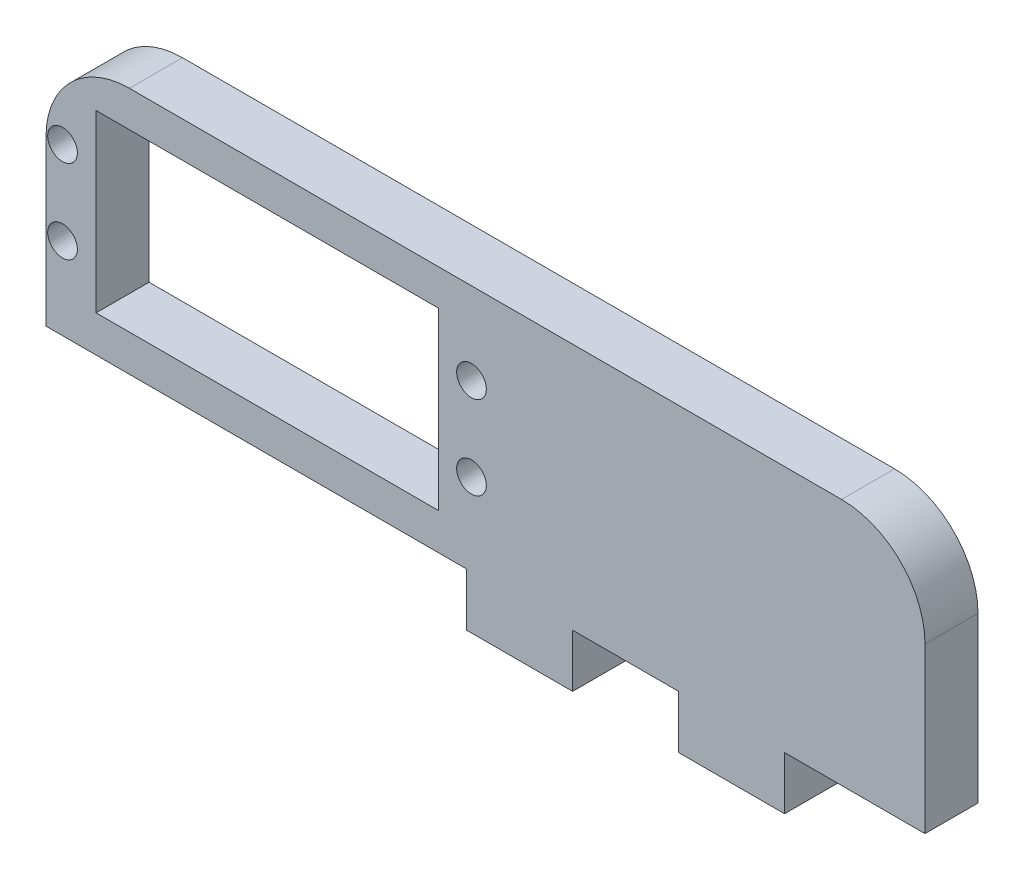
from build123d import *

# Parameters (mm, degrees)
BOSS_EXTRUDE1_DEPTH = 6.35
SKETCH3_R           = 1.778
SKETCH3_W           = 41
SKETCH3_H           = 21
CUT_EXTRUDE1_DEPTH  = 102.778507746
FILLET1_R           = 10


with BuildPart() as part:
    # Sketch1 → Boss-Extrude1 (new body)
    with BuildSketch(Plane.XY):
        Polygon((19.05, 38.1), (19.05, 44.45), (35.872396717, 44.45), (35.872396717, 74.129883576), (-49.45, 74.129883576), (-69.45, 74.129883576), (-69.45, 44.45), (-44.45, 44.45), (-19.05, 44.45), (-19.05, 38.1), (-6.35, 38.1), (-6.35, 44.45), (6.35, 44.45), (6.35, 38.1), align=None)
    extrude(amount=BOSS_EXTRUDE1_DEPTH)

    # Sketch3 → Cut-Extrude1 (cut, through all)
    with BuildSketch(Plane.XY.offset(6.35)):
        with Locations((-67.4705, 64.289941788)):
            Circle(SKETCH3_R)
        with Locations((-67.4705, 54.289941788)):
            Circle(SKETCH3_R)
        with Locations((-18.4705, 54.289941788)):
            Circle(SKETCH3_R)
        with Locations((-18.4705, 64.289941788)):
            Circle(SKETCH3_R)
        with Locations((-42.95, 59.329883576)):
            Rectangle(SKETCH3_W, SKETCH3_H)
    extrude(amount=-CUT_EXTRUDE1_DEPTH, mode=Mode.SUBTRACT)

    # Fillet1
    fillet1_edges = [part.edges().sort_by_distance(p)[0] for p in [
        (-69.45, 74.129883576, 3.175),
        (35.872396717, 74.129883576, 3.175),
    ]]
    fillet(fillet1_edges, radius=FILLET1_R)


solid = part.part
